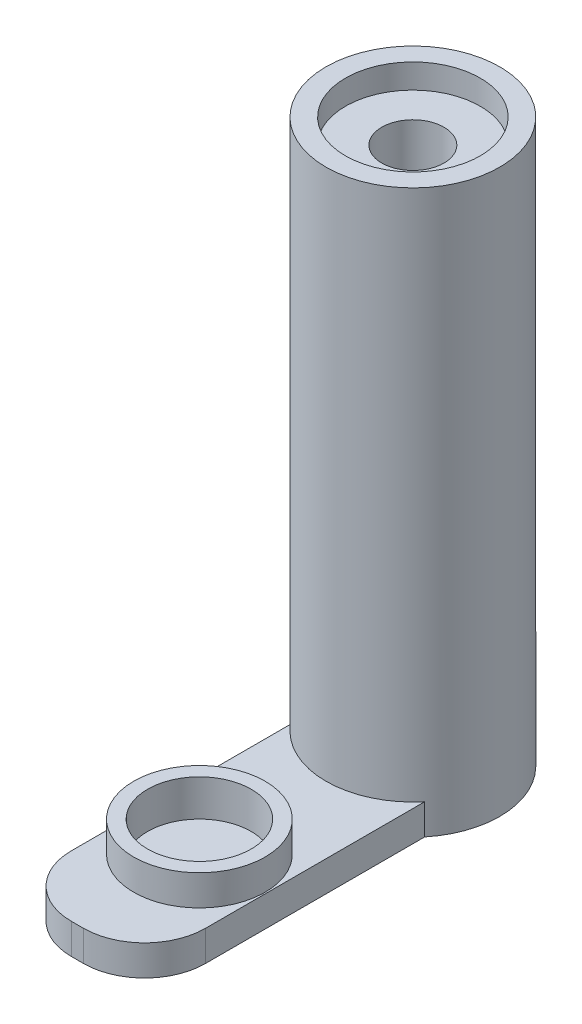
from build123d import *

# Parameters (mm, degrees)
SKETCH1_R           = 14.25
BOSS_EXTRUDE1_DEPTH = 92.2
SKETCH2_R           = 5.1
CUT_EXTRUDE1_DEPTH  = 92.2
SKETCH3_R           = 11.05
CUT_EXTRUDE2_DEPTH  = 4
BOSS_EXTRUDE2_DEPTH = 5
SKETCH6_R           = 8.5
CUT_EXTRUDE3_DEPTH  = 1
FILLET1_R           = 10
BOSS_EXTRUDE3_START = 5
SKETCH7_R           = 10.773488024
SKETCH7_R_2         = 8.5
BOSS_EXTRUDE3_DEPTH = 5


with BuildPart() as part:
    # Sketch1 → Boss-Extrude1 (new body)
    with BuildSketch(Plane(origin=(0, 0, 0), x_dir=(1, 0, 0), z_dir=(0, 1, 0))):
        with Locations(Location((0, 0, 0), (0, 0, 270))):
            Circle(SKETCH1_R)
    extrude(amount=BOSS_EXTRUDE1_DEPTH)

    # Sketch2 → Cut-Extrude1 (cut)
    with BuildSketch(Plane(origin=(0, 92.2, 0), x_dir=(1, 0, 0), z_dir=(0, 1, 0))):
        with Locations(Location((0, 0, 0), (0, 0, 270))):
            Circle(SKETCH2_R)
    extrude(amount=-CUT_EXTRUDE1_DEPTH, mode=Mode.SUBTRACT)

    # Sketch3 → Cut-Extrude2 (cut)
    with BuildSketch(Plane(origin=(0, 92.2, 0), x_dir=(1, 0, 0), z_dir=(0, 1, 0))):
        with Locations(Location((0, 0, 0), (0, 0, 270))):
            Circle(SKETCH3_R)
    extrude(amount=-CUT_EXTRUDE2_DEPTH, mode=Mode.SUBTRACT)

    # Sketch4 → Boss-Extrude2 (add)
    with BuildSketch(Plane.XZ):
        with BuildLine():
            Line((-11, 55), (11, 55))
            Line((11, 55), (11, 9.058835466))
            ThreePointArc((11, 9.058835466), (0, -14.25), (-11, 9.058835466))
            Line((-11, 9.058835466), (-11, 55))
        make_face()
    extrude(amount=-BOSS_EXTRUDE2_DEPTH)

    # Sketch6 → Cut-Extrude3 (cut)
    with BuildSketch(Plane(origin=(0, 5, 0), x_dir=(1, 0, 0), z_dir=(0, 1, 0))):
        with Locations(Location((0, -35, 0), (0, 0, 270))):
            Circle(SKETCH6_R)
    extrude(amount=-CUT_EXTRUDE3_DEPTH, mode=Mode.SUBTRACT)

    # Fillet1
    fillet1_edges = [part.edges().sort_by_distance(p)[0] for p in [
        (-11, 2.5, 55),
        (11, 2.5, 55),
    ]]
    fillet(fillet1_edges, radius=FILLET1_R)

    # Sketch7 → Boss-Extrude3 (add)
    with BuildSketch(Plane(origin=(0, 5, 0), x_dir=(1, 0, 0), z_dir=(0, 1, 0)).offset(BOSS_EXTRUDE3_START)):
        with Locations(Location((0, -35, 0), (0, 0, 90))):
            Circle(SKETCH7_R)
        with Locations(Location((0, -35, 0), (0, 0, 270))):
            Circle(SKETCH7_R_2, mode=Mode.SUBTRACT)
    extrude(amount=-BOSS_EXTRUDE3_DEPTH)


solid = part.part
